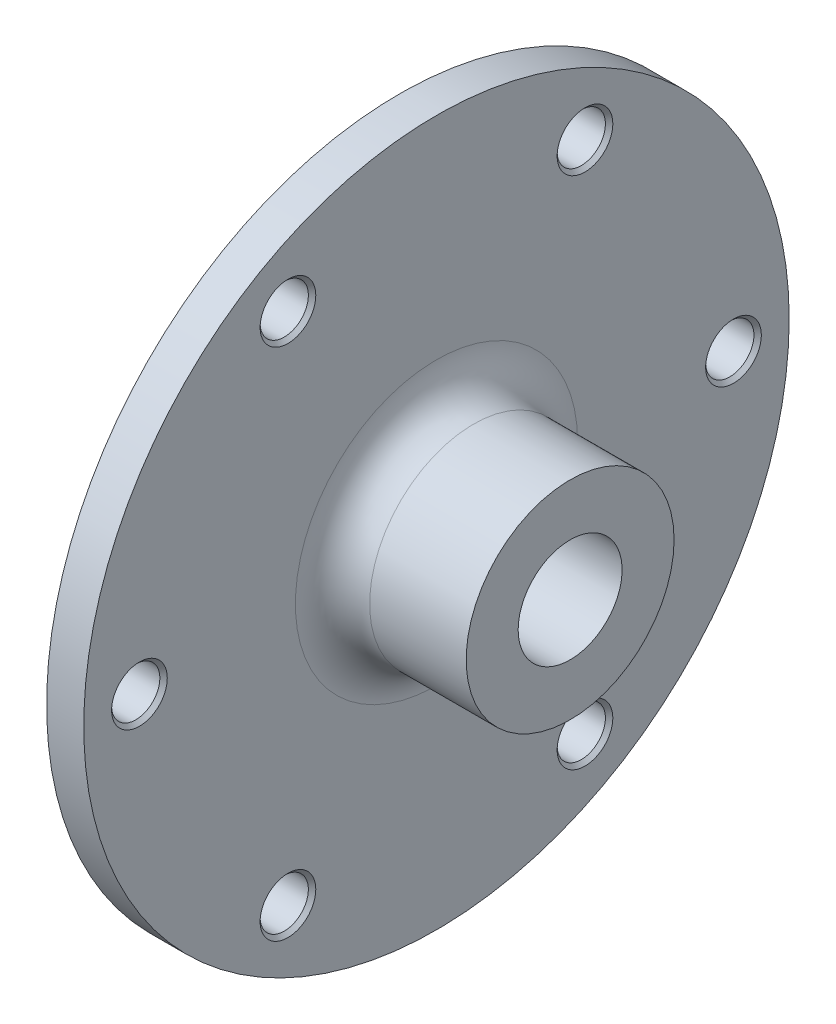
from build123d import *

# Parameters (mm, degrees)
FILLET1_R                                            = 5
CSK_FOR_M12_HEX_SOCKET_COUNTERSUNK_CAP_S_D           = 14
CSK_FOR_M12_HEX_SOCKET_COUNTERSUNK_CAP_S_CSINK_D     = 26
CSK_FOR_M12_HEX_SOCKET_COUNTERSUNK_CAP_S_CSINK_ANGLE = 90
CSK_FOR_M6_HEX_SOCKET_COUNTERSUNK_CAP_SC_D           = 6.5
CSK_FOR_M6_HEX_SOCKET_COUNTERSUNK_CAP_SC_CSINK_D     = 7.5
CSK_FOR_M6_HEX_SOCKET_COUNTERSUNK_CAP_SC_CSINK_ANGLE = 90
CIRPATTERN1_COUNT                                    = 6


with BuildPart() as part:
    # Sketch1 → Revolve1 (revolve)
    with BuildSketch(Plane.XY, mode=Mode.PRIVATE) as revolve1_sk:
        Polygon((0, 0), (-28, 0), (-28, 35), (-23, 35), (-23, 47.5), (-18, 47.5), (-18, 14), (0, 14), align=None)
    revolve(revolve1_sk.sketch.rotate(Axis((0, 0, 0), (-1, 0, 0)), 90), axis=Axis((0, 0, 0), (-1, 0, 0)))

    # Fillet1
    fillet1_edges = [part.edges().sort_by_distance(p)[0] for p in [
        (-18, 0, 14),
    ]]
    fillet(fillet1_edges, radius=FILLET1_R)

    # CSK for M12 Hex Socket Countersunk Cap Screw1 (through all)
    with Locations(Plane.ZY.offset(28)):
        with Locations((0, 0)):
            CounterSinkHole(CSK_FOR_M12_HEX_SOCKET_COUNTERSUNK_CAP_S_D / 2, CSK_FOR_M12_HEX_SOCKET_COUNTERSUNK_CAP_S_CSINK_D / 2, counter_sink_angle=CSK_FOR_M12_HEX_SOCKET_COUNTERSUNK_CAP_S_CSINK_ANGLE)

    # CSK for M6 Hex Socket Countersunk Cap Screw1 (through all)
    with Locations(Plane(origin=(-18, 0, 0), x_dir=(0, 0, -1), z_dir=(1, 0, 0))):
        with Locations((-40, 0)):
            csk_for_m6_hex_socket_countersunk_cap_sc = CounterSinkHole(CSK_FOR_M6_HEX_SOCKET_COUNTERSUNK_CAP_SC_D / 2, CSK_FOR_M6_HEX_SOCKET_COUNTERSUNK_CAP_SC_CSINK_D / 2, counter_sink_angle=CSK_FOR_M6_HEX_SOCKET_COUNTERSUNK_CAP_SC_CSINK_ANGLE)

    # CirPattern1: CSK for M6 Hex Socket Countersunk Cap Screw1 ×6 about axis
    cirpattern1_axis = Axis((0, 0, 0), (1, 0, 0))
    for i in range(1, CIRPATTERN1_COUNT):
        add(csk_for_m6_hex_socket_countersunk_cap_sc.rotate(cirpattern1_axis, i * 360 / CIRPATTERN1_COUNT), mode=Mode.SUBTRACT)


solid = part.part
